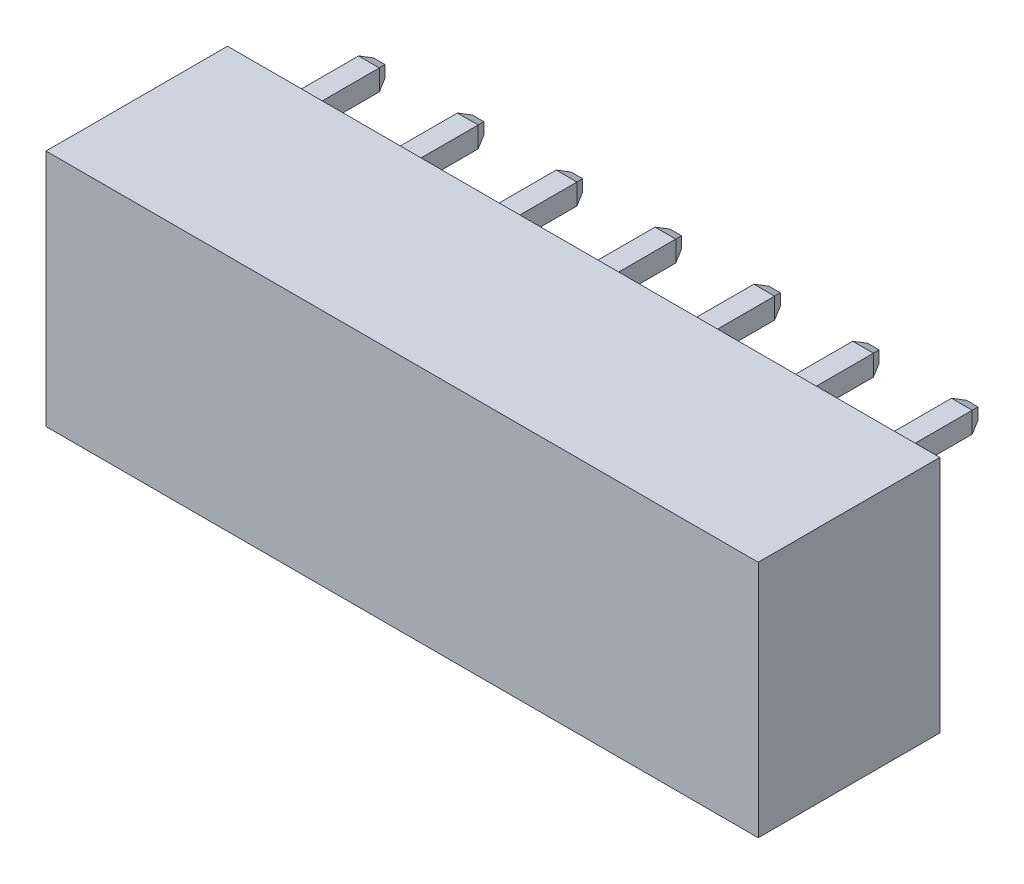
from build123d import *
from OCP.BRepFilletAPI import BRepFilletAPI_MakeChamfer

# Parameters (mm, degrees)
SKETCH_1_W                          = 27.46
SKETCH_1_H                          = 9.2
EXTRUDE_1_DEPTH                     = 7
SKETCH_2_W                          = 0.8
SKETCH_2_H                          = 0.8
EXTRUDE_2_DEPTH                     = 3.4
CHAMFER_1_SIZE                      = 0.4
CHAMFER_1_SIZE2                     = 0.178091474
CUT_EXTRUDE_1_DEPTH                 = 7
PATTERN_LINEAR_1_COUNT              = 7
PATTERN_LINEAR_1_PITCH              = 3.81
CHAMFER_1_OF_PATTERN_LINEAR_1_SIZE  = 0.4
CHAMFER_1_OF_PATTERN_LINEAR_1_SIZE2 = 0.178091474
PATTERN_LINEAR_2_COUNT              = 7
PATTERN_LINEAR_2_PITCH              = 3.81
SKETCH_4_W                          = 0.8
SKETCH_4_H                          = 0.8
EXTRUDE_3_DEPTH                     = 6
CHAMFER_2_SIZE                      = 0.4
CHAMFER_2_SIZE2                     = 0.178091474
PATTERN_LINEAR_3_COUNT              = 7
PATTERN_LINEAR_3_PITCH              = 3.81
CHAMFER_2_OF_PATTERN_LINEAR_3_SIZE  = 0.4
CHAMFER_2_OF_PATTERN_LINEAR_3_SIZE2 = 0.178091474


with BuildPart() as part:
    # Эскиз1 → Бобышка-Вытянуть1 (new body)
    with BuildSketch(Plane.XY):
        with Locations((0, 4.6)):
            Rectangle(SKETCH_1_W, SKETCH_1_H)
    extrude(amount=EXTRUDE_1_DEPTH)

    # Эскиз2 → Бобышка-Вытянуть2 (add)
    with BuildSketch(Plane(origin=(0, 0, 0), x_dir=(-1, 0, 0), z_dir=(0, 0, -1))):
        with Locations((-11.58, 8)):
            Rectangle(SKETCH_2_W, SKETCH_2_H)
    extrude_2 = extrude(amount=EXTRUDE_2_DEPTH)

    # Фаска1: one chamfer whose edges measure the first distance from different faces: ONE call of the kernel's chamfer builder (chamfer() names one face for all edges)
    chamfer_1_edges_1 = [part.edges().sort_by_distance(p)[0] for p in [
        (11.18, 8, -3.4),
    ]]
    chamfer_1_side_1 = [part.faces().sort_by_distance(p)[0] for p in [
        (11.18, 8, -1.7),
    ]]
    chamfer_1_edges_2 = [part.edges().sort_by_distance(p)[0] for p in [
        (11.58, 8.4, -3.4),
    ]]
    chamfer_1_side_2 = [part.faces().sort_by_distance(p)[0] for p in [
        (11.58, 8.4, -1.7),
    ]]
    chamfer_1_edges_3 = [part.edges().sort_by_distance(p)[0] for p in [
        (11.98, 8, -3.4),
    ]]
    chamfer_1_side_3 = [part.faces().sort_by_distance(p)[0] for p in [
        (11.98, 8, -1.7),
    ]]
    chamfer_1_edges_4 = [part.edges().sort_by_distance(p)[0] for p in [
        (11.58, 7.6, -3.4),
    ]]
    chamfer_1_side_4 = [part.faces().sort_by_distance(p)[0] for p in [
        (11.58, 7.6, -1.7),
    ]]
    chamfer_1 = BRepFilletAPI_MakeChamfer(part.part.solid().wrapped)
    for e in chamfer_1_edges_1:
        chamfer_1.Add(CHAMFER_1_SIZE, CHAMFER_1_SIZE2, e.wrapped, chamfer_1_side_1[0].wrapped)  # the first distance lies on this face
    for e in chamfer_1_edges_2:
        chamfer_1.Add(CHAMFER_1_SIZE, CHAMFER_1_SIZE2, e.wrapped, chamfer_1_side_2[0].wrapped)  # the first distance lies on this face
    for e in chamfer_1_edges_3:
        chamfer_1.Add(CHAMFER_1_SIZE, CHAMFER_1_SIZE2, e.wrapped, chamfer_1_side_3[0].wrapped)  # the first distance lies on this face
    for e in chamfer_1_edges_4:
        chamfer_1.Add(CHAMFER_1_SIZE, CHAMFER_1_SIZE2, e.wrapped, chamfer_1_side_4[0].wrapped)  # the first distance lies on this face
    add(Compound.cast(chamfer_1.Shape()), mode=Mode.REPLACE)

    # Эскиз3 → Вырез-Вытянуть1 (cut)
    with BuildSketch(Plane.XZ):
        Polygon((9.98, 0.8), (13.08, 0.8), (13.08, 5), (12.08, 5), (13.08, 6.5), (9.98, 6.5), (10.98, 5), (9.98, 5), align=None)
    cut_extrude_1 = extrude(amount=-CUT_EXTRUDE_1_DEPTH, mode=Mode.SUBTRACT)

    # Линейный массив1: Бобышка-Вытянуть2 ×7
    with Locations(*[(-i * PATTERN_LINEAR_1_PITCH, 0, 0) for i in range(1, PATTERN_LINEAR_1_COUNT)]):
        add(extrude_2)

    # Фаска1 of Линейный массив1: one chamfer whose edges measure the first distance from different faces: ONE call of the kernel's chamfer builder (chamfer() names one face for all edges)
    chamfer_1_of_pattern_linear_1_edges_1 = [part.edges().sort_by_distance(p)[0] for p in [
        (7.37, 8, -3.4),
    ]]
    chamfer_1_of_pattern_linear_1_side_1 = [part.faces().sort_by_distance(p)[0] for p in [
        (7.37, 8, -1.7),
    ]]
    chamfer_1_of_pattern_linear_1_edges_2 = [part.edges().sort_by_distance(p)[0] for p in [
        (7.77, 8.4, -3.4),
    ]]
    chamfer_1_of_pattern_linear_1_side_2 = [part.faces().sort_by_distance(p)[0] for p in [
        (7.77, 8.4, -1.7),
    ]]
    chamfer_1_of_pattern_linear_1_edges_3 = [part.edges().sort_by_distance(p)[0] for p in [
        (8.17, 8, -3.4),
    ]]
    chamfer_1_of_pattern_linear_1_side_3 = [part.faces().sort_by_distance(p)[0] for p in [
        (8.17, 8, -1.7),
    ]]
    chamfer_1_of_pattern_linear_1_edges_4 = [part.edges().sort_by_distance(p)[0] for p in [
        (7.77, 7.6, -3.4),
    ]]
    chamfer_1_of_pattern_linear_1_side_4 = [part.faces().sort_by_distance(p)[0] for p in [
        (7.77, 7.6, -1.7),
    ]]
    chamfer_1_of_pattern_linear_1_edges_5 = [part.edges().sort_by_distance(p)[0] for p in [
        (3.56, 8, -3.4),
    ]]
    chamfer_1_of_pattern_linear_1_side_5 = [part.faces().sort_by_distance(p)[0] for p in [
        (3.56, 8, -1.7),
    ]]
    chamfer_1_of_pattern_linear_1_edges_6 = [part.edges().sort_by_distance(p)[0] for p in [
        (3.96, 8.4, -3.4),
    ]]
    chamfer_1_of_pattern_linear_1_side_6 = [part.faces().sort_by_distance(p)[0] for p in [
        (3.96, 8.4, -1.7),
    ]]
    chamfer_1_of_pattern_linear_1_edges_7 = [part.edges().sort_by_distance(p)[0] for p in [
        (4.36, 8, -3.4),
    ]]
    chamfer_1_of_pattern_linear_1_side_7 = [part.faces().sort_by_distance(p)[0] for p in [
        (4.36, 8, -1.7),
    ]]
    chamfer_1_of_pattern_linear_1_edges_8 = [part.edges().sort_by_distance(p)[0] for p in [
        (3.96, 7.6, -3.4),
    ]]
    chamfer_1_of_pattern_linear_1_side_8 = [part.faces().sort_by_distance(p)[0] for p in [
        (3.96, 7.6, -1.7),
    ]]
    chamfer_1_of_pattern_linear_1_edges_9 = [part.edges().sort_by_distance(p)[0] for p in [
        (-0.25, 8, -3.4),
    ]]
    chamfer_1_of_pattern_linear_1_side_9 = [part.faces().sort_by_distance(p)[0] for p in [
        (-0.25, 8, -1.7),
    ]]
    chamfer_1_of_pattern_linear_1_edges_10 = [part.edges().sort_by_distance(p)[0] for p in [
        (0.15, 8.4, -3.4),
    ]]
    chamfer_1_of_pattern_linear_1_side_10 = [part.faces().sort_by_distance(p)[0] for p in [
        (0.15, 8.4, -1.7),
    ]]
    chamfer_1_of_pattern_linear_1_edges_11 = [part.edges().sort_by_distance(p)[0] for p in [
        (0.55, 8, -3.4),
    ]]
    chamfer_1_of_pattern_linear_1_side_11 = [part.faces().sort_by_distance(p)[0] for p in [
        (0.55, 8, -1.7),
    ]]
    chamfer_1_of_pattern_linear_1_edges_12 = [part.edges().sort_by_distance(p)[0] for p in [
        (0.15, 7.6, -3.4),
    ]]
    chamfer_1_of_pattern_linear_1_side_12 = [part.faces().sort_by_distance(p)[0] for p in [
        (0.15, 7.6, -1.7),
    ]]
    chamfer_1_of_pattern_linear_1_edges_13 = [part.edges().sort_by_distance(p)[0] for p in [
        (-4.06, 8, -3.4),
    ]]
    chamfer_1_of_pattern_linear_1_side_13 = [part.faces().sort_by_distance(p)[0] for p in [
        (-4.06, 8, -1.7),
    ]]
    chamfer_1_of_pattern_linear_1_edges_14 = [part.edges().sort_by_distance(p)[0] for p in [
        (-3.66, 8.4, -3.4),
    ]]
    chamfer_1_of_pattern_linear_1_side_14 = [part.faces().sort_by_distance(p)[0] for p in [
        (-3.66, 8.4, -1.7),
    ]]
    chamfer_1_of_pattern_linear_1_edges_15 = [part.edges().sort_by_distance(p)[0] for p in [
        (-3.26, 8, -3.4),
    ]]
    chamfer_1_of_pattern_linear_1_side_15 = [part.faces().sort_by_distance(p)[0] for p in [
        (-3.26, 8, -1.7),
    ]]
    chamfer_1_of_pattern_linear_1_edges_16 = [part.edges().sort_by_distance(p)[0] for p in [
        (-3.66, 7.6, -3.4),
    ]]
    chamfer_1_of_pattern_linear_1_side_16 = [part.faces().sort_by_distance(p)[0] for p in [
        (-3.66, 7.6, -1.7),
    ]]
    chamfer_1_of_pattern_linear_1_edges_17 = [part.edges().sort_by_distance(p)[0] for p in [
        (-7.87, 8, -3.4),
    ]]
    chamfer_1_of_pattern_linear_1_side_17 = [part.faces().sort_by_distance(p)[0] for p in [
        (-7.87, 8, -1.7),
    ]]
    chamfer_1_of_pattern_linear_1_edges_18 = [part.edges().sort_by_distance(p)[0] for p in [
        (-7.47, 8.4, -3.4),
    ]]
    chamfer_1_of_pattern_linear_1_side_18 = [part.faces().sort_by_distance(p)[0] for p in [
        (-7.47, 8.4, -1.7),
    ]]
    chamfer_1_of_pattern_linear_1_edges_19 = [part.edges().sort_by_distance(p)[0] for p in [
        (-7.07, 8, -3.4),
    ]]
    chamfer_1_of_pattern_linear_1_side_19 = [part.faces().sort_by_distance(p)[0] for p in [
        (-7.07, 8, -1.7),
    ]]
    chamfer_1_of_pattern_linear_1_edges_20 = [part.edges().sort_by_distance(p)[0] for p in [
        (-7.47, 7.6, -3.4),
    ]]
    chamfer_1_of_pattern_linear_1_side_20 = [part.faces().sort_by_distance(p)[0] for p in [
        (-7.47, 7.6, -1.7),
    ]]
    chamfer_1_of_pattern_linear_1_edges_21 = [part.edges().sort_by_distance(p)[0] for p in [
        (-11.68, 8, -3.4),
    ]]
    chamfer_1_of_pattern_linear_1_side_21 = [part.faces().sort_by_distance(p)[0] for p in [
        (-11.68, 8, -1.7),
    ]]
    chamfer_1_of_pattern_linear_1_edges_22 = [part.edges().sort_by_distance(p)[0] for p in [
        (-11.28, 8.4, -3.4),
    ]]
    chamfer_1_of_pattern_linear_1_side_22 = [part.faces().sort_by_distance(p)[0] for p in [
        (-11.28, 8.4, -1.7),
    ]]
    chamfer_1_of_pattern_linear_1_edges_23 = [part.edges().sort_by_distance(p)[0] for p in [
        (-10.88, 8, -3.4),
    ]]
    chamfer_1_of_pattern_linear_1_side_23 = [part.faces().sort_by_distance(p)[0] for p in [
        (-10.88, 8, -1.7),
    ]]
    chamfer_1_of_pattern_linear_1_edges_24 = [part.edges().sort_by_distance(p)[0] for p in [
        (-11.28, 7.6, -3.4),
    ]]
    chamfer_1_of_pattern_linear_1_side_24 = [part.faces().sort_by_distance(p)[0] for p in [
        (-11.28, 7.6, -1.7),
    ]]
    chamfer_1_of_pattern_linear_1 = BRepFilletAPI_MakeChamfer(part.part.solid().wrapped)
    for e in chamfer_1_of_pattern_linear_1_edges_1:
        chamfer_1_of_pattern_linear_1.Add(CHAMFER_1_OF_PATTERN_LINEAR_1_SIZE, CHAMFER_1_OF_PATTERN_LINEAR_1_SIZE2, e.wrapped, chamfer_1_of_pattern_linear_1_side_1[0].wrapped)  # the first distance lies on this face
    for e in chamfer_1_of_pattern_linear_1_edges_2:
        chamfer_1_of_pattern_linear_1.Add(CHAMFER_1_OF_PATTERN_LINEAR_1_SIZE, CHAMFER_1_OF_PATTERN_LINEAR_1_SIZE2, e.wrapped, chamfer_1_of_pattern_linear_1_side_2[0].wrapped)  # the first distance lies on this face
    for e in chamfer_1_of_pattern_linear_1_edges_3:
        chamfer_1_of_pattern_linear_1.Add(CHAMFER_1_OF_PATTERN_LINEAR_1_SIZE, CHAMFER_1_OF_PATTERN_LINEAR_1_SIZE2, e.wrapped, chamfer_1_of_pattern_linear_1_side_3[0].wrapped)  # the first distance lies on this face
    for e in chamfer_1_of_pattern_linear_1_edges_4:
        chamfer_1_of_pattern_linear_1.Add(CHAMFER_1_OF_PATTERN_LINEAR_1_SIZE, CHAMFER_1_OF_PATTERN_LINEAR_1_SIZE2, e.wrapped, chamfer_1_of_pattern_linear_1_side_4[0].wrapped)  # the first distance lies on this face
    for e in chamfer_1_of_pattern_linear_1_edges_5:
        chamfer_1_of_pattern_linear_1.Add(CHAMFER_1_OF_PATTERN_LINEAR_1_SIZE, CHAMFER_1_OF_PATTERN_LINEAR_1_SIZE2, e.wrapped, chamfer_1_of_pattern_linear_1_side_5[0].wrapped)  # the first distance lies on this face
    for e in chamfer_1_of_pattern_linear_1_edges_6:
        chamfer_1_of_pattern_linear_1.Add(CHAMFER_1_OF_PATTERN_LINEAR_1_SIZE, CHAMFER_1_OF_PATTERN_LINEAR_1_SIZE2, e.wrapped, chamfer_1_of_pattern_linear_1_side_6[0].wrapped)  # the first distance lies on this face
    for e in chamfer_1_of_pattern_linear_1_edges_7:
        chamfer_1_of_pattern_linear_1.Add(CHAMFER_1_OF_PATTERN_LINEAR_1_SIZE, CHAMFER_1_OF_PATTERN_LINEAR_1_SIZE2, e.wrapped, chamfer_1_of_pattern_linear_1_side_7[0].wrapped)  # the first distance lies on this face
    for e in chamfer_1_of_pattern_linear_1_edges_8:
        chamfer_1_of_pattern_linear_1.Add(CHAMFER_1_OF_PATTERN_LINEAR_1_SIZE, CHAMFER_1_OF_PATTERN_LINEAR_1_SIZE2, e.wrapped, chamfer_1_of_pattern_linear_1_side_8[0].wrapped)  # the first distance lies on this face
    for e in chamfer_1_of_pattern_linear_1_edges_9:
        chamfer_1_of_pattern_linear_1.Add(CHAMFER_1_OF_PATTERN_LINEAR_1_SIZE, CHAMFER_1_OF_PATTERN_LINEAR_1_SIZE2, e.wrapped, chamfer_1_of_pattern_linear_1_side_9[0].wrapped)  # the first distance lies on this face
    for e in chamfer_1_of_pattern_linear_1_edges_10:
        chamfer_1_of_pattern_linear_1.Add(CHAMFER_1_OF_PATTERN_LINEAR_1_SIZE, CHAMFER_1_OF_PATTERN_LINEAR_1_SIZE2, e.wrapped, chamfer_1_of_pattern_linear_1_side_10[0].wrapped)  # the first distance lies on this face
    for e in chamfer_1_of_pattern_linear_1_edges_11:
        chamfer_1_of_pattern_linear_1.Add(CHAMFER_1_OF_PATTERN_LINEAR_1_SIZE, CHAMFER_1_OF_PATTERN_LINEAR_1_SIZE2, e.wrapped, chamfer_1_of_pattern_linear_1_side_11[0].wrapped)  # the first distance lies on this face
    for e in chamfer_1_of_pattern_linear_1_edges_12:
        chamfer_1_of_pattern_linear_1.Add(CHAMFER_1_OF_PATTERN_LINEAR_1_SIZE, CHAMFER_1_OF_PATTERN_LINEAR_1_SIZE2, e.wrapped, chamfer_1_of_pattern_linear_1_side_12[0].wrapped)  # the first distance lies on this face
    for e in chamfer_1_of_pattern_linear_1_edges_13:
        chamfer_1_of_pattern_linear_1.Add(CHAMFER_1_OF_PATTERN_LINEAR_1_SIZE, CHAMFER_1_OF_PATTERN_LINEAR_1_SIZE2, e.wrapped, chamfer_1_of_pattern_linear_1_side_13[0].wrapped)  # the first distance lies on this face
    for e in chamfer_1_of_pattern_linear_1_edges_14:
        chamfer_1_of_pattern_linear_1.Add(CHAMFER_1_OF_PATTERN_LINEAR_1_SIZE, CHAMFER_1_OF_PATTERN_LINEAR_1_SIZE2, e.wrapped, chamfer_1_of_pattern_linear_1_side_14[0].wrapped)  # the first distance lies on this face
    for e in chamfer_1_of_pattern_linear_1_edges_15:
        chamfer_1_of_pattern_linear_1.Add(CHAMFER_1_OF_PATTERN_LINEAR_1_SIZE, CHAMFER_1_OF_PATTERN_LINEAR_1_SIZE2, e.wrapped, chamfer_1_of_pattern_linear_1_side_15[0].wrapped)  # the first distance lies on this face
    for e in chamfer_1_of_pattern_linear_1_edges_16:
        chamfer_1_of_pattern_linear_1.Add(CHAMFER_1_OF_PATTERN_LINEAR_1_SIZE, CHAMFER_1_OF_PATTERN_LINEAR_1_SIZE2, e.wrapped, chamfer_1_of_pattern_linear_1_side_16[0].wrapped)  # the first distance lies on this face
    for e in chamfer_1_of_pattern_linear_1_edges_17:
        chamfer_1_of_pattern_linear_1.Add(CHAMFER_1_OF_PATTERN_LINEAR_1_SIZE, CHAMFER_1_OF_PATTERN_LINEAR_1_SIZE2, e.wrapped, chamfer_1_of_pattern_linear_1_side_17[0].wrapped)  # the first distance lies on this face
    for e in chamfer_1_of_pattern_linear_1_edges_18:
        chamfer_1_of_pattern_linear_1.Add(CHAMFER_1_OF_PATTERN_LINEAR_1_SIZE, CHAMFER_1_OF_PATTERN_LINEAR_1_SIZE2, e.wrapped, chamfer_1_of_pattern_linear_1_side_18[0].wrapped)  # the first distance lies on this face
    for e in chamfer_1_of_pattern_linear_1_edges_19:
        chamfer_1_of_pattern_linear_1.Add(CHAMFER_1_OF_PATTERN_LINEAR_1_SIZE, CHAMFER_1_OF_PATTERN_LINEAR_1_SIZE2, e.wrapped, chamfer_1_of_pattern_linear_1_side_19[0].wrapped)  # the first distance lies on this face
    for e in chamfer_1_of_pattern_linear_1_edges_20:
        chamfer_1_of_pattern_linear_1.Add(CHAMFER_1_OF_PATTERN_LINEAR_1_SIZE, CHAMFER_1_OF_PATTERN_LINEAR_1_SIZE2, e.wrapped, chamfer_1_of_pattern_linear_1_side_20[0].wrapped)  # the first distance lies on this face
    for e in chamfer_1_of_pattern_linear_1_edges_21:
        chamfer_1_of_pattern_linear_1.Add(CHAMFER_1_OF_PATTERN_LINEAR_1_SIZE, CHAMFER_1_OF_PATTERN_LINEAR_1_SIZE2, e.wrapped, chamfer_1_of_pattern_linear_1_side_21[0].wrapped)  # the first distance lies on this face
    for e in chamfer_1_of_pattern_linear_1_edges_22:
        chamfer_1_of_pattern_linear_1.Add(CHAMFER_1_OF_PATTERN_LINEAR_1_SIZE, CHAMFER_1_OF_PATTERN_LINEAR_1_SIZE2, e.wrapped, chamfer_1_of_pattern_linear_1_side_22[0].wrapped)  # the first distance lies on this face
    for e in chamfer_1_of_pattern_linear_1_edges_23:
        chamfer_1_of_pattern_linear_1.Add(CHAMFER_1_OF_PATTERN_LINEAR_1_SIZE, CHAMFER_1_OF_PATTERN_LINEAR_1_SIZE2, e.wrapped, chamfer_1_of_pattern_linear_1_side_23[0].wrapped)  # the first distance lies on this face
    for e in chamfer_1_of_pattern_linear_1_edges_24:
        chamfer_1_of_pattern_linear_1.Add(CHAMFER_1_OF_PATTERN_LINEAR_1_SIZE, CHAMFER_1_OF_PATTERN_LINEAR_1_SIZE2, e.wrapped, chamfer_1_of_pattern_linear_1_side_24[0].wrapped)  # the first distance lies on this face
    add(Compound.cast(chamfer_1_of_pattern_linear_1.Shape()), mode=Mode.REPLACE)

    # Линейный массив2: Вырез-Вытянуть1 ×7
    with Locations(*[(-i * PATTERN_LINEAR_2_PITCH, 0, 0) for i in range(1, PATTERN_LINEAR_2_COUNT)]):
        add(cut_extrude_1, mode=Mode.SUBTRACT)

    # Эскиз4 → Бобышка-Вытянуть3 (add)
    with BuildSketch(Plane.XZ.offset(-7)):
        with Locations((11.58, 3)):
            Rectangle(SKETCH_4_W, SKETCH_4_H)
    extrude_3 = extrude(amount=EXTRUDE_3_DEPTH)

    # Фаска2: one chamfer whose edges measure the first distance from different faces: ONE call of the kernel's chamfer builder (chamfer() names one face for all edges)
    chamfer_2_edges_1 = [part.edges().sort_by_distance(p)[0] for p in [
        (11.98, 1, 3),
    ]]
    chamfer_2_side_1 = [part.faces().sort_by_distance(p)[0] for p in [
        (11.98, 4, 3),
    ]]
    chamfer_2_edges_2 = [part.edges().sort_by_distance(p)[0] for p in [
        (11.58, 1, 3.4),
    ]]
    chamfer_2_side_2 = [part.faces().sort_by_distance(p)[0] for p in [
        (11.58, 4, 3.4),
    ]]
    chamfer_2_edges_3 = [part.edges().sort_by_distance(p)[0] for p in [
        (11.18, 1, 3),
    ]]
    chamfer_2_side_3 = [part.faces().sort_by_distance(p)[0] for p in [
        (11.18, 4, 3),
    ]]
    chamfer_2_edges_4 = [part.edges().sort_by_distance(p)[0] for p in [
        (11.58, 1, 2.6),
    ]]
    chamfer_2_side_4 = [part.faces().sort_by_distance(p)[0] for p in [
        (11.58, 4, 2.6),
    ]]
    chamfer_2 = BRepFilletAPI_MakeChamfer(part.part.solid().wrapped)
    for e in chamfer_2_edges_1:
        chamfer_2.Add(CHAMFER_2_SIZE, CHAMFER_2_SIZE2, e.wrapped, chamfer_2_side_1[0].wrapped)  # the first distance lies on this face
    for e in chamfer_2_edges_2:
        chamfer_2.Add(CHAMFER_2_SIZE, CHAMFER_2_SIZE2, e.wrapped, chamfer_2_side_2[0].wrapped)  # the first distance lies on this face
    for e in chamfer_2_edges_3:
        chamfer_2.Add(CHAMFER_2_SIZE, CHAMFER_2_SIZE2, e.wrapped, chamfer_2_side_3[0].wrapped)  # the first distance lies on this face
    for e in chamfer_2_edges_4:
        chamfer_2.Add(CHAMFER_2_SIZE, CHAMFER_2_SIZE2, e.wrapped, chamfer_2_side_4[0].wrapped)  # the first distance lies on this face
    add(Compound.cast(chamfer_2.Shape()), mode=Mode.REPLACE)

    # Линейный массив3: Бобышка-Вытянуть3 ×7
    with Locations(*[(-i * PATTERN_LINEAR_3_PITCH, 0, 0) for i in range(1, PATTERN_LINEAR_3_COUNT)]):
        add(extrude_3)

    # Фаска2 of Линейный массив3: one chamfer whose edges measure the first distance from different faces: ONE call of the kernel's chamfer builder (chamfer() names one face for all edges)
    chamfer_2_of_pattern_linear_3_edges_1 = [part.edges().sort_by_distance(p)[0] for p in [
        (8.17, 1, 3),
    ]]
    chamfer_2_of_pattern_linear_3_side_1 = [part.faces().sort_by_distance(p)[0] for p in [
        (8.17, 4, 3),
    ]]
    chamfer_2_of_pattern_linear_3_edges_2 = [part.edges().sort_by_distance(p)[0] for p in [
        (7.77, 1, 3.4),
    ]]
    chamfer_2_of_pattern_linear_3_side_2 = [part.faces().sort_by_distance(p)[0] for p in [
        (7.77, 4, 3.4),
    ]]
    chamfer_2_of_pattern_linear_3_edges_3 = [part.edges().sort_by_distance(p)[0] for p in [
        (7.37, 1, 3),
    ]]
    chamfer_2_of_pattern_linear_3_side_3 = [part.faces().sort_by_distance(p)[0] for p in [
        (7.37, 4, 3),
    ]]
    chamfer_2_of_pattern_linear_3_edges_4 = [part.edges().sort_by_distance(p)[0] for p in [
        (7.77, 1, 2.6),
    ]]
    chamfer_2_of_pattern_linear_3_side_4 = [part.faces().sort_by_distance(p)[0] for p in [
        (7.77, 4, 2.6),
    ]]
    chamfer_2_of_pattern_linear_3_edges_5 = [part.edges().sort_by_distance(p)[0] for p in [
        (4.36, 1, 3),
    ]]
    chamfer_2_of_pattern_linear_3_side_5 = [part.faces().sort_by_distance(p)[0] for p in [
        (4.36, 4, 3),
    ]]
    chamfer_2_of_pattern_linear_3_edges_6 = [part.edges().sort_by_distance(p)[0] for p in [
        (3.96, 1, 3.4),
    ]]
    chamfer_2_of_pattern_linear_3_side_6 = [part.faces().sort_by_distance(p)[0] for p in [
        (3.96, 4, 3.4),
    ]]
    chamfer_2_of_pattern_linear_3_edges_7 = [part.edges().sort_by_distance(p)[0] for p in [
        (3.56, 1, 3),
    ]]
    chamfer_2_of_pattern_linear_3_side_7 = [part.faces().sort_by_distance(p)[0] for p in [
        (3.56, 4, 3),
    ]]
    chamfer_2_of_pattern_linear_3_edges_8 = [part.edges().sort_by_distance(p)[0] for p in [
        (3.96, 1, 2.6),
    ]]
    chamfer_2_of_pattern_linear_3_side_8 = [part.faces().sort_by_distance(p)[0] for p in [
        (3.96, 4, 2.6),
    ]]
    chamfer_2_of_pattern_linear_3_edges_9 = [part.edges().sort_by_distance(p)[0] for p in [
        (0.55, 1, 3),
    ]]
    chamfer_2_of_pattern_linear_3_side_9 = [part.faces().sort_by_distance(p)[0] for p in [
        (0.55, 4, 3),
    ]]
    chamfer_2_of_pattern_linear_3_edges_10 = [part.edges().sort_by_distance(p)[0] for p in [
        (0.15, 1, 3.4),
    ]]
    chamfer_2_of_pattern_linear_3_side_10 = [part.faces().sort_by_distance(p)[0] for p in [
        (0.15, 4, 3.4),
    ]]
    chamfer_2_of_pattern_linear_3_edges_11 = [part.edges().sort_by_distance(p)[0] for p in [
        (-0.25, 1, 3),
    ]]
    chamfer_2_of_pattern_linear_3_side_11 = [part.faces().sort_by_distance(p)[0] for p in [
        (-0.25, 4, 3),
    ]]
    chamfer_2_of_pattern_linear_3_edges_12 = [part.edges().sort_by_distance(p)[0] for p in [
        (0.15, 1, 2.6),
    ]]
    chamfer_2_of_pattern_linear_3_side_12 = [part.faces().sort_by_distance(p)[0] for p in [
        (0.15, 4, 2.6),
    ]]
    chamfer_2_of_pattern_linear_3_edges_13 = [part.edges().sort_by_distance(p)[0] for p in [
        (-3.26, 1, 3),
    ]]
    chamfer_2_of_pattern_linear_3_side_13 = [part.faces().sort_by_distance(p)[0] for p in [
        (-3.26, 4, 3),
    ]]
    chamfer_2_of_pattern_linear_3_edges_14 = [part.edges().sort_by_distance(p)[0] for p in [
        (-3.66, 1, 3.4),
    ]]
    chamfer_2_of_pattern_linear_3_side_14 = [part.faces().sort_by_distance(p)[0] for p in [
        (-3.66, 4, 3.4),
    ]]
    chamfer_2_of_pattern_linear_3_edges_15 = [part.edges().sort_by_distance(p)[0] for p in [
        (-4.06, 1, 3),
    ]]
    chamfer_2_of_pattern_linear_3_side_15 = [part.faces().sort_by_distance(p)[0] for p in [
        (-4.06, 4, 3),
    ]]
    chamfer_2_of_pattern_linear_3_edges_16 = [part.edges().sort_by_distance(p)[0] for p in [
        (-3.66, 1, 2.6),
    ]]
    chamfer_2_of_pattern_linear_3_side_16 = [part.faces().sort_by_distance(p)[0] for p in [
        (-3.66, 4, 2.6),
    ]]
    chamfer_2_of_pattern_linear_3_edges_17 = [part.edges().sort_by_distance(p)[0] for p in [
        (-7.07, 1, 3),
    ]]
    chamfer_2_of_pattern_linear_3_side_17 = [part.faces().sort_by_distance(p)[0] for p in [
        (-7.07, 4, 3),
    ]]
    chamfer_2_of_pattern_linear_3_edges_18 = [part.edges().sort_by_distance(p)[0] for p in [
        (-7.47, 1, 3.4),
    ]]
    chamfer_2_of_pattern_linear_3_side_18 = [part.faces().sort_by_distance(p)[0] for p in [
        (-7.47, 4, 3.4),
    ]]
    chamfer_2_of_pattern_linear_3_edges_19 = [part.edges().sort_by_distance(p)[0] for p in [
        (-7.87, 1, 3),
    ]]
    chamfer_2_of_pattern_linear_3_side_19 = [part.faces().sort_by_distance(p)[0] for p in [
        (-7.87, 4, 3),
    ]]
    chamfer_2_of_pattern_linear_3_edges_20 = [part.edges().sort_by_distance(p)[0] for p in [
        (-7.47, 1, 2.6),
    ]]
    chamfer_2_of_pattern_linear_3_side_20 = [part.faces().sort_by_distance(p)[0] for p in [
        (-7.47, 4, 2.6),
    ]]
    chamfer_2_of_pattern_linear_3_edges_21 = [part.edges().sort_by_distance(p)[0] for p in [
        (-10.88, 1, 3),
    ]]
    chamfer_2_of_pattern_linear_3_side_21 = [part.faces().sort_by_distance(p)[0] for p in [
        (-10.88, 4, 3),
    ]]
    chamfer_2_of_pattern_linear_3_edges_22 = [part.edges().sort_by_distance(p)[0] for p in [
        (-11.28, 1, 3.4),
    ]]
    chamfer_2_of_pattern_linear_3_side_22 = [part.faces().sort_by_distance(p)[0] for p in [
        (-11.28, 4, 3.4),
    ]]
    chamfer_2_of_pattern_linear_3_edges_23 = [part.edges().sort_by_distance(p)[0] for p in [
        (-11.68, 1, 3),
    ]]
    chamfer_2_of_pattern_linear_3_side_23 = [part.faces().sort_by_distance(p)[0] for p in [
        (-11.68, 4, 3),
    ]]
    chamfer_2_of_pattern_linear_3_edges_24 = [part.edges().sort_by_distance(p)[0] for p in [
        (-11.28, 1, 2.6),
    ]]
    chamfer_2_of_pattern_linear_3_side_24 = [part.faces().sort_by_distance(p)[0] for p in [
        (-11.28, 4, 2.6),
    ]]
    chamfer_2_of_pattern_linear_3 = BRepFilletAPI_MakeChamfer(part.part.solid().wrapped)
    for e in chamfer_2_of_pattern_linear_3_edges_1:
        chamfer_2_of_pattern_linear_3.Add(CHAMFER_2_OF_PATTERN_LINEAR_3_SIZE, CHAMFER_2_OF_PATTERN_LINEAR_3_SIZE2, e.wrapped, chamfer_2_of_pattern_linear_3_side_1[0].wrapped)  # the first distance lies on this face
    for e in chamfer_2_of_pattern_linear_3_edges_2:
        chamfer_2_of_pattern_linear_3.Add(CHAMFER_2_OF_PATTERN_LINEAR_3_SIZE, CHAMFER_2_OF_PATTERN_LINEAR_3_SIZE2, e.wrapped, chamfer_2_of_pattern_linear_3_side_2[0].wrapped)  # the first distance lies on this face
    for e in chamfer_2_of_pattern_linear_3_edges_3:
        chamfer_2_of_pattern_linear_3.Add(CHAMFER_2_OF_PATTERN_LINEAR_3_SIZE, CHAMFER_2_OF_PATTERN_LINEAR_3_SIZE2, e.wrapped, chamfer_2_of_pattern_linear_3_side_3[0].wrapped)  # the first distance lies on this face
    for e in chamfer_2_of_pattern_linear_3_edges_4:
        chamfer_2_of_pattern_linear_3.Add(CHAMFER_2_OF_PATTERN_LINEAR_3_SIZE, CHAMFER_2_OF_PATTERN_LINEAR_3_SIZE2, e.wrapped, chamfer_2_of_pattern_linear_3_side_4[0].wrapped)  # the first distance lies on this face
    for e in chamfer_2_of_pattern_linear_3_edges_5:
        chamfer_2_of_pattern_linear_3.Add(CHAMFER_2_OF_PATTERN_LINEAR_3_SIZE, CHAMFER_2_OF_PATTERN_LINEAR_3_SIZE2, e.wrapped, chamfer_2_of_pattern_linear_3_side_5[0].wrapped)  # the first distance lies on this face
    for e in chamfer_2_of_pattern_linear_3_edges_6:
        chamfer_2_of_pattern_linear_3.Add(CHAMFER_2_OF_PATTERN_LINEAR_3_SIZE, CHAMFER_2_OF_PATTERN_LINEAR_3_SIZE2, e.wrapped, chamfer_2_of_pattern_linear_3_side_6[0].wrapped)  # the first distance lies on this face
    for e in chamfer_2_of_pattern_linear_3_edges_7:
        chamfer_2_of_pattern_linear_3.Add(CHAMFER_2_OF_PATTERN_LINEAR_3_SIZE, CHAMFER_2_OF_PATTERN_LINEAR_3_SIZE2, e.wrapped, chamfer_2_of_pattern_linear_3_side_7[0].wrapped)  # the first distance lies on this face
    for e in chamfer_2_of_pattern_linear_3_edges_8:
        chamfer_2_of_pattern_linear_3.Add(CHAMFER_2_OF_PATTERN_LINEAR_3_SIZE, CHAMFER_2_OF_PATTERN_LINEAR_3_SIZE2, e.wrapped, chamfer_2_of_pattern_linear_3_side_8[0].wrapped)  # the first distance lies on this face
    for e in chamfer_2_of_pattern_linear_3_edges_9:
        chamfer_2_of_pattern_linear_3.Add(CHAMFER_2_OF_PATTERN_LINEAR_3_SIZE, CHAMFER_2_OF_PATTERN_LINEAR_3_SIZE2, e.wrapped, chamfer_2_of_pattern_linear_3_side_9[0].wrapped)  # the first distance lies on this face
    for e in chamfer_2_of_pattern_linear_3_edges_10:
        chamfer_2_of_pattern_linear_3.Add(CHAMFER_2_OF_PATTERN_LINEAR_3_SIZE, CHAMFER_2_OF_PATTERN_LINEAR_3_SIZE2, e.wrapped, chamfer_2_of_pattern_linear_3_side_10[0].wrapped)  # the first distance lies on this face
    for e in chamfer_2_of_pattern_linear_3_edges_11:
        chamfer_2_of_pattern_linear_3.Add(CHAMFER_2_OF_PATTERN_LINEAR_3_SIZE, CHAMFER_2_OF_PATTERN_LINEAR_3_SIZE2, e.wrapped, chamfer_2_of_pattern_linear_3_side_11[0].wrapped)  # the first distance lies on this face
    for e in chamfer_2_of_pattern_linear_3_edges_12:
        chamfer_2_of_pattern_linear_3.Add(CHAMFER_2_OF_PATTERN_LINEAR_3_SIZE, CHAMFER_2_OF_PATTERN_LINEAR_3_SIZE2, e.wrapped, chamfer_2_of_pattern_linear_3_side_12[0].wrapped)  # the first distance lies on this face
    for e in chamfer_2_of_pattern_linear_3_edges_13:
        chamfer_2_of_pattern_linear_3.Add(CHAMFER_2_OF_PATTERN_LINEAR_3_SIZE, CHAMFER_2_OF_PATTERN_LINEAR_3_SIZE2, e.wrapped, chamfer_2_of_pattern_linear_3_side_13[0].wrapped)  # the first distance lies on this face
    for e in chamfer_2_of_pattern_linear_3_edges_14:
        chamfer_2_of_pattern_linear_3.Add(CHAMFER_2_OF_PATTERN_LINEAR_3_SIZE, CHAMFER_2_OF_PATTERN_LINEAR_3_SIZE2, e.wrapped, chamfer_2_of_pattern_linear_3_side_14[0].wrapped)  # the first distance lies on this face
    for e in chamfer_2_of_pattern_linear_3_edges_15:
        chamfer_2_of_pattern_linear_3.Add(CHAMFER_2_OF_PATTERN_LINEAR_3_SIZE, CHAMFER_2_OF_PATTERN_LINEAR_3_SIZE2, e.wrapped, chamfer_2_of_pattern_linear_3_side_15[0].wrapped)  # the first distance lies on this face
    for e in chamfer_2_of_pattern_linear_3_edges_16:
        chamfer_2_of_pattern_linear_3.Add(CHAMFER_2_OF_PATTERN_LINEAR_3_SIZE, CHAMFER_2_OF_PATTERN_LINEAR_3_SIZE2, e.wrapped, chamfer_2_of_pattern_linear_3_side_16[0].wrapped)  # the first distance lies on this face
    for e in chamfer_2_of_pattern_linear_3_edges_17:
        chamfer_2_of_pattern_linear_3.Add(CHAMFER_2_OF_PATTERN_LINEAR_3_SIZE, CHAMFER_2_OF_PATTERN_LINEAR_3_SIZE2, e.wrapped, chamfer_2_of_pattern_linear_3_side_17[0].wrapped)  # the first distance lies on this face
    for e in chamfer_2_of_pattern_linear_3_edges_18:
        chamfer_2_of_pattern_linear_3.Add(CHAMFER_2_OF_PATTERN_LINEAR_3_SIZE, CHAMFER_2_OF_PATTERN_LINEAR_3_SIZE2, e.wrapped, chamfer_2_of_pattern_linear_3_side_18[0].wrapped)  # the first distance lies on this face
    for e in chamfer_2_of_pattern_linear_3_edges_19:
        chamfer_2_of_pattern_linear_3.Add(CHAMFER_2_OF_PATTERN_LINEAR_3_SIZE, CHAMFER_2_OF_PATTERN_LINEAR_3_SIZE2, e.wrapped, chamfer_2_of_pattern_linear_3_side_19[0].wrapped)  # the first distance lies on this face
    for e in chamfer_2_of_pattern_linear_3_edges_20:
        chamfer_2_of_pattern_linear_3.Add(CHAMFER_2_OF_PATTERN_LINEAR_3_SIZE, CHAMFER_2_OF_PATTERN_LINEAR_3_SIZE2, e.wrapped, chamfer_2_of_pattern_linear_3_side_20[0].wrapped)  # the first distance lies on this face
    for e in chamfer_2_of_pattern_linear_3_edges_21:
        chamfer_2_of_pattern_linear_3.Add(CHAMFER_2_OF_PATTERN_LINEAR_3_SIZE, CHAMFER_2_OF_PATTERN_LINEAR_3_SIZE2, e.wrapped, chamfer_2_of_pattern_linear_3_side_21[0].wrapped)  # the first distance lies on this face
    for e in chamfer_2_of_pattern_linear_3_edges_22:
        chamfer_2_of_pattern_linear_3.Add(CHAMFER_2_OF_PATTERN_LINEAR_3_SIZE, CHAMFER_2_OF_PATTERN_LINEAR_3_SIZE2, e.wrapped, chamfer_2_of_pattern_linear_3_side_22[0].wrapped)  # the first distance lies on this face
    for e in chamfer_2_of_pattern_linear_3_edges_23:
        chamfer_2_of_pattern_linear_3.Add(CHAMFER_2_OF_PATTERN_LINEAR_3_SIZE, CHAMFER_2_OF_PATTERN_LINEAR_3_SIZE2, e.wrapped, chamfer_2_of_pattern_linear_3_side_23[0].wrapped)  # the first distance lies on this face
    for e in chamfer_2_of_pattern_linear_3_edges_24:
        chamfer_2_of_pattern_linear_3.Add(CHAMFER_2_OF_PATTERN_LINEAR_3_SIZE, CHAMFER_2_OF_PATTERN_LINEAR_3_SIZE2, e.wrapped, chamfer_2_of_pattern_linear_3_side_24[0].wrapped)  # the first distance lies on this face
    add(Compound.cast(chamfer_2_of_pattern_linear_3.Shape()), mode=Mode.REPLACE)


solid = part.part
